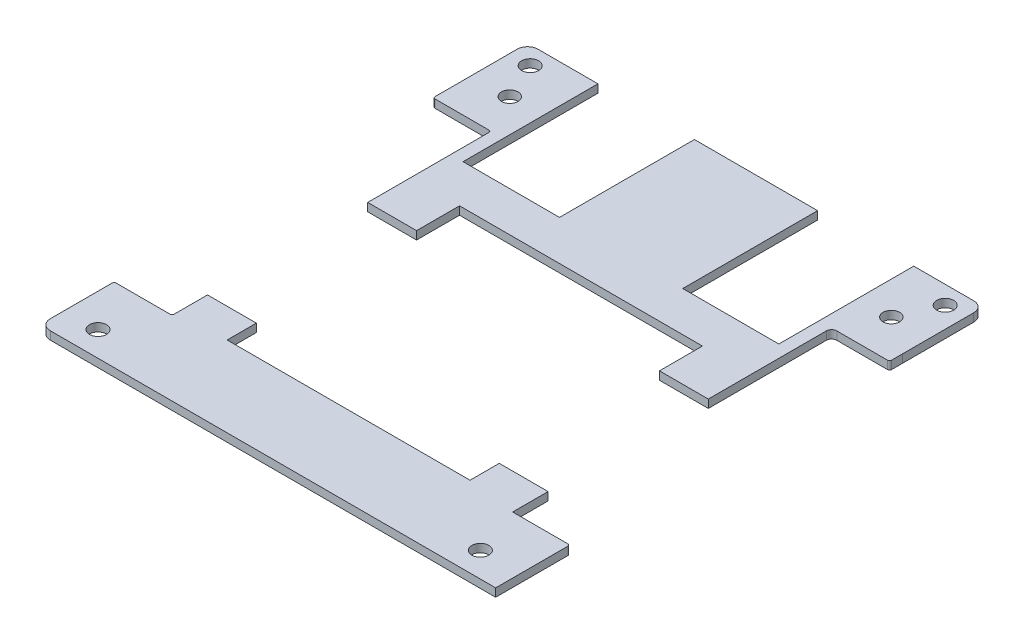
from build123d import *

# Parameters (mm, degrees)
SKETCH1_R           = 1.6383
BOSS_EXTRUDE1_DEPTH = 1.575
CUT_EXTRUDE1_DEPTH  = 2.54
SKETCH15_R          = 1.6
CUT_EXTRUDE5_DEPTH  = 65.400936523
BOSS_EXTRUDE2_DEPTH = 1.575
CUT_EXTRUDE7_DEPTH  = 65.400936523
SKETCH21_W          = 65.646785141
SKETCH21_H          = 2.674
CUT_EXTRUDE10_DEPTH = 65.400936523


with BuildPart() as part:
    # Sketch1 → Boss-Extrude1 (new body)
    with BuildSketch(Plane(origin=(0, 0, 0), x_dir=(1, 0, 0), z_dir=(0, 1, 0))):
        with BuildLine():
            Line((-44, 45), (-44, 29.162404323))
            ThreePointArc((-44, 29.162404323), (-43.886381258, 28.888104416), (-43.612081351, 28.774485674))
            Line((-43.612081351, 28.774485674), (-33.211918649, 28.774485674))
            ThreePointArc((-33.211918649, 28.774485674), (-32.937618742, 28.660866933), (-32.824, 28.386567026))
            Line((-32.824, 28.386567026), (-32.824, -32.305595677))
            ThreePointArc((-32.824, -32.305595677), (-32.937618742, -32.579895584), (-33.211918649, -32.693514326))
            Line((-33.211918649, -32.693514326), (-36.100000052, -32.693514326))
            Line((-36.100000052, -32.693514326), (-43.612081299, -32.693514326))
            ThreePointArc((-43.612081299, -32.693514326), (-43.886381206, -32.807133067), (-43.999999948, -33.081432974))
            Line((-43.999999948, -33.081432974), (-43.999999948, -38.977))
            Line((-43.999999948, -38.977), (-43.999999948, -45))
            ThreePointArc((-43.999999948, -45), (-43.41421351, -46.414213562), (-41.999999948, -47))
            Line((-41.999999948, -47), (42.705916546, -47))
            Line((42.705916546, -47), (43.849731117, -47))
            Line((43.849731117, -47), (43.849731117, -38.27))
            Line((43.849731117, -38.27), (43.849731117, -33.081432974))
            ThreePointArc((43.849731117, -33.081432974), (43.736112376, -32.807133067), (43.461812469, -32.693514326))
            Line((43.461812469, -32.693514326), (36.098785193, -32.693514326))
            Line((36.098785193, -32.693514326), (33.824, -32.693514326))
            Line((33.824, -32.693514326), (32.822785141, -32.693514326))
            Line((32.822785141, -32.693514326), (32.822785141, -30.469351623))
            Line((32.822785141, -30.469351623), (32.822785141, 27.774485674))
            ThreePointArc((32.822785141, 27.774485674), (33.11567836, 28.481592456), (33.822785141, 28.774485674))
            Line((33.822785141, 28.774485674), (43.611054239, 28.774485674))
            ThreePointArc((43.611054239, 28.774485674), (43.885287743, 28.88803803), (43.998972842, 29.162216531))
            Line((43.998972842, 29.162216531), (44, 31.284))
            Line((44, 31.284), (44, 45))
            ThreePointArc((44, 45), (43.414213562, 46.414213562), (42, 47))
            Line((42, 47), (-42, 47))
            ThreePointArc((-42, 47), (-43.414213562, 46.414213562), (-44, 45))
        make_face()
        with Locations(Location((40, 43.5, 0), (0, 0, 270))):
            Circle(SKETCH1_R, mode=Mode.SUBTRACT)
        with Locations(Location((-40, 43.5, 0), (0, 0, 270))):
            Circle(SKETCH1_R, mode=Mode.SUBTRACT)
        with Locations(Location((-37.599999948, -42.2, 0), (0, 0, 270))):
            Circle(SKETCH1_R, mode=Mode.SUBTRACT)
        with Locations(Location((36.100000052, -42.2, 0), (0, 0, 270))):
            Circle(SKETCH1_R, mode=Mode.SUBTRACT)
        Polygon((23.409, -31.5), (-23.409, -31.5), (-23.409, 13.29544), (-12.909, 13.29544), (-12.909, 25.99544), (12.909, 25.99544), (12.909, 13.29544), (23.409, 13.29544), align=None, mode=Mode.SUBTRACT)
    extrude(amount=BOSS_EXTRUDE1_DEPTH)

    # Sketch2 → Cut-Extrude1 (cut)
    with BuildSketch(Plane(origin=(0, 1.575, 0), x_dir=(1, 0, 0), z_dir=(0, 1, 0))):
        Polygon((-12.909, 19.06), (-30.435, 19.06), (-30.435, 47), (30.435, 47), (30.435, 19.06), (12.909, 19.06), (12.909, 25.99544), (-12.909, 25.99544), align=None)
    extrude(amount=-CUT_EXTRUDE1_DEPTH, mode=Mode.SUBTRACT)

    # Sketch15 → Cut-Extrude5 (cut, through all)
    with BuildSketch(Plane(origin=(0, 1.575, 0), x_dir=(1, 0, 0), z_dir=(0, 1, 0))):
        with Locations(Location((-36.785, 36.35, 0), (0, 0, 270))):
            Circle(SKETCH15_R)
        with Locations(Location((36.785, 36.332, 0), (0, 0, 270))):
            Circle(SKETCH15_R)
    extrude(amount=-CUT_EXTRUDE5_DEPTH, mode=Mode.SUBTRACT)

    # Sketch16 → Boss-Extrude2 (add)
    with BuildSketch(Plane(origin=(0, 1.575, 0), x_dir=(1, 0, 0), z_dir=(0, 1, 0))):
        Polygon((12.909, 19.06), (12.909, 13.29544), (-12.909, 13.29544), (-12.909, 19.06), (-30.435, 19.06), (-30.435, 21), (-11.838888217, 21), (-11.838888217, 47), (11.909, 47), (11.909, 21), (30.435, 21), (30.435, 19.06), align=None)
    extrude(amount=-BOSS_EXTRUDE2_DEPTH)

    # Sketch17 → Cut-Extrude7 (cut, through all)
    with BuildSketch(Plane(origin=(0, 1.575, 0), x_dir=(1, 0, 0), z_dir=(0, 1, 0))):
        Polygon((-42.620402532, -10.524407413), (-42.620402532, -23.19180025), (43.180071614, -23.19180025), (43.180071614, -10.524407413), (43.180071614, 5.014261133), (-42.620402532, 5.014261133), align=None)
    extrude(amount=-CUT_EXTRUDE7_DEPTH, mode=Mode.SUBTRACT)


with BuildPart() as cut_extrude7_piece_1:
    # of the separate pieces the step leaves, piece 1, a body of its own (cut_extrude7_pieces)
    add(part.part.solids().sort_by_distance((-44, 0, -45))[0])


with BuildPart() as cut_extrude7_piece_2:
    # of the separate pieces the step leaves, piece 2, a body of its own (cut_extrude7_pieces)
    add(part.part.solids().sort_by_distance((-32.824, 0, 23.19180025))[0])

    # Sketch21 → Cut-Extrude10 (cut, through all)
    with BuildSketch(Plane(origin=(0, 1.575, 0), x_dir=(1, 0, 0), z_dir=(0, 1, 0))):
        with Locations((-0.00060743, -24.52880025)):
            Rectangle(SKETCH21_W, SKETCH21_H)
    extrude(amount=-CUT_EXTRUDE10_DEPTH, mode=Mode.SUBTRACT)


solid = Compound([cut_extrude7_piece_1.part, cut_extrude7_piece_2.part])
